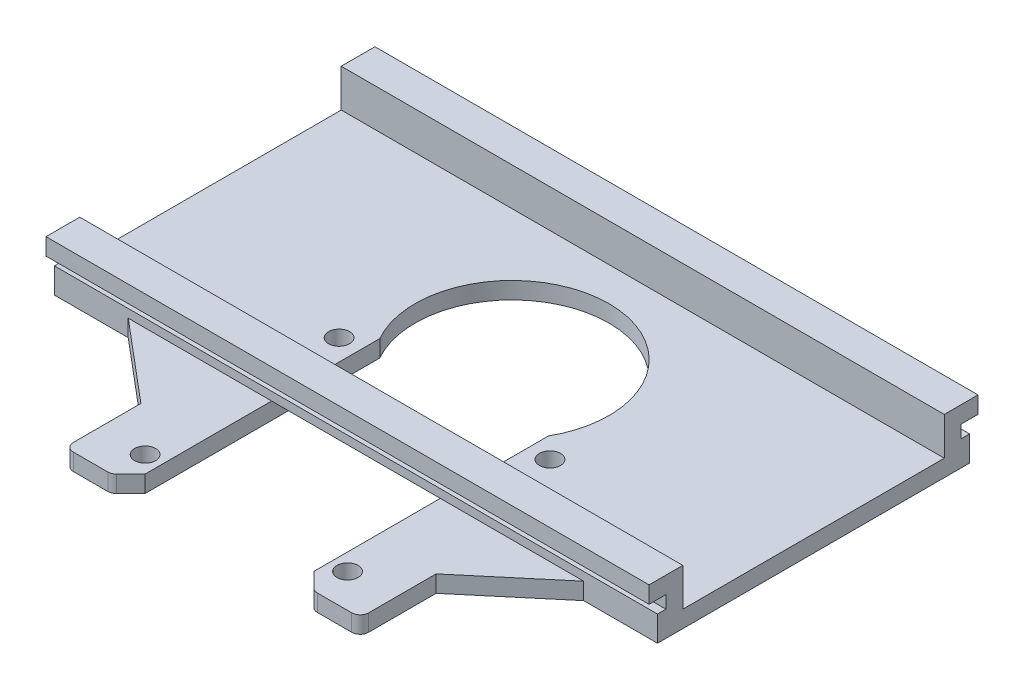
from build123d import *

# Parameters (mm, degrees)
CROQUIS1_R              = 1.25
SALIENTE_EXTRUIR1_DEPTH = 2
SALIENTE_EXTRUIR2_DEPTH = 71.5


with BuildPart() as part:
    # Croquis1 → Saliente-Extruir1 (new body)
    with BuildSketch(Plane(origin=(0, 0, 0), x_dir=(1, 0, 0), z_dir=(0, 1, 0))):
        with BuildLine():
            Line((36.224750286, -45.279704968), (34.517643505, -43.572598187))
            Line((34.517643505, -43.572598187), (34.517643505, -15.751506533))
            ThreePointArc((34.517643505, -15.751506533), (24.517643505, 1.427401813), (14.517643505, -15.751506533))
            Line((14.517643505, -15.751506533), (14.517643505, -43.572598187))
            Line((14.517643505, -43.572598187), (12.810536723, -45.279704968))
            ThreePointArc((12.810536723, -45.279704968), (12.486113375, -45.49647772), (12.103429942, -45.572598187))
            Line((12.103429942, -45.572598187), (8.017643505, -45.572598187))
            ThreePointArc((8.017643505, -45.572598187), (7.310536723, -45.279704968), (7.017643505, -44.572598187))
            Line((7.017643505, -44.572598187), (7.017643505, -36.572598187))
            Line((7.017643505, -36.572598187), (-2.482356495, -28.572598187))
            Line((-2.482356495, -28.572598187), (-11.232356495, -28.572598187))
            Line((-11.232356495, -28.572598187), (-11.232356495, 8.427401813))
            Line((-11.232356495, 8.427401813), (60.267643505, 8.427401813))
            Line((60.267643505, 8.427401813), (60.267643505, -28.572598187))
            Line((60.267643505, -28.572598187), (51.517643505, -28.572598187))
            Line((51.517643505, -28.572598187), (42.017643505, -36.572598187))
            Line((42.017643505, -36.572598187), (42.017643505, -44.572598187))
            ThreePointArc((42.017643505, -44.572598187), (41.724750286, -45.279704968), (41.017643505, -45.572598187))
            Line((41.017643505, -45.572598187), (36.931857067, -45.572598187))
            ThreePointArc((36.931857067, -45.572598187), (36.549173635, -45.49647772), (36.224750286, -45.279704968))
        make_face()
        with Locations(Location((37.017643505, -18.072598187, 0), (0, 0, 90))):
            Circle(CROQUIS1_R, mode=Mode.SUBTRACT)
        with Locations(Location((36.517643505, -41.572598187, 0), (0, 0, 90))):
            Circle(CROQUIS1_R, mode=Mode.SUBTRACT)
        with Locations(Location((12.517643505, -41.572598187, 0), (0, 0, 270))):
            Circle(CROQUIS1_R, mode=Mode.SUBTRACT)
        with Locations(Location((12.017643505, -18.072598187, 0), (0, 0, 270))):
            Circle(CROQUIS1_R, mode=Mode.SUBTRACT)
    extrude(amount=-SALIENTE_EXTRUIR1_DEPTH)

    # Croquis3 → Saliente-Extruir2 (add)
    with BuildSketch(Plane(origin=(60.267643505, 0, 0), x_dir=(0, 0, -1), z_dir=(1, 0, 0))):
        Polygon((-25.572598187, 0), (-25.572598187, 4.5), (-29.572598187, 4.5), (-29.572598187, 2.5), (-27.572598187, 2.5), (-27.572598187, 1), (-28.572598187, 1), (-28.572598187, 0), align=None)
        Polygon((5.427401813, 4.5), (9.427401813, 4.5), (9.427401813, 2.5), (7.427401813, 2.5), (7.427401813, 1), (8.427401813, 1), (8.427401813, 0), (5.427401813, 0), align=None)
    extrude(amount=-SALIENTE_EXTRUIR2_DEPTH)


solid = part.part
